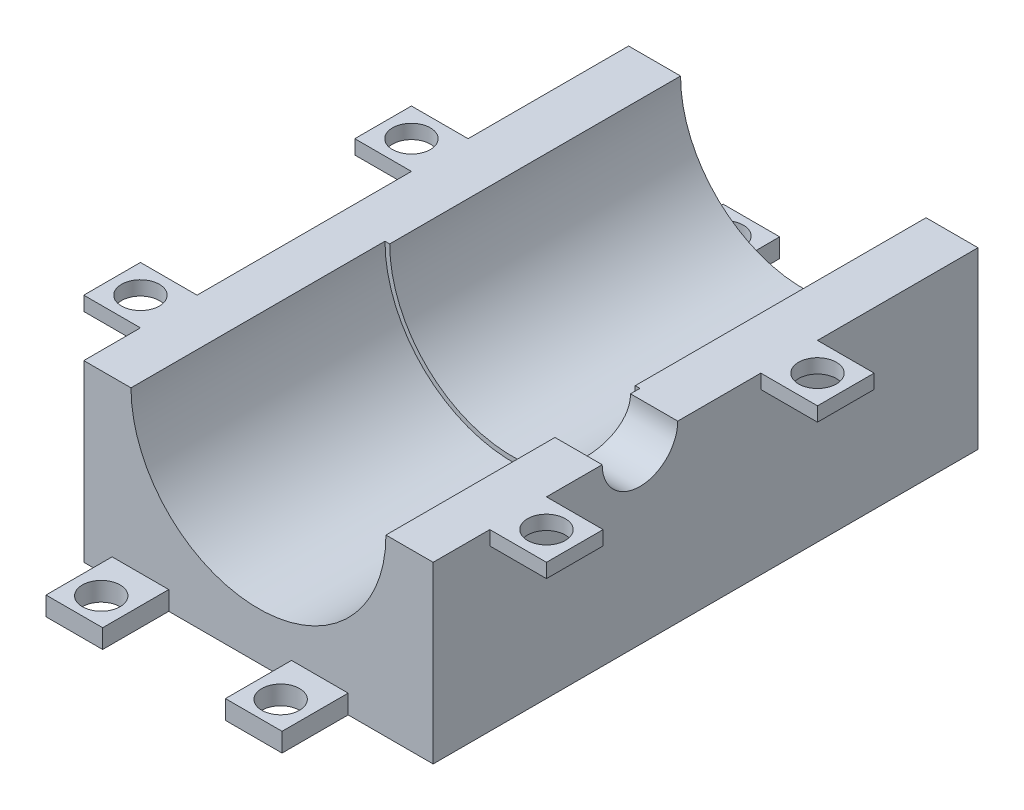
from build123d import *

# Parameters (mm, degrees)
EXTRUDE_1_DEPTH     = 57.7
EXTRUDE_2_DEPTH     = 30.8
SKETCH_5_R          = 4
CUT_EXTRUDE_1_DEPTH = 15
SKETCH_7_W          = 6
SKETCH_7_H          = 7
SKETCH_7_R          = 2
EXTRUDE_3_DEPTH     = 2
SKETCH_8_W          = 6
SKETCH_8_H          = 1.5
EXTRUDE_4_DEPTH     = 6
EXTRUDE_START       = -37
SKETCH_8_3_W        = 6
SKETCH_8_3_H        = 1.5
EXTRUDE_5_DEPTH     = 6
SKETCH_9_R          = 2
CUT_EXTRUDE_2_DEPTH = 6
SKETCH_10_R         = 13
CUT_EXTRUDE_3_DEPTH = 49.696406438


with BuildPart() as part:
    # 스케치1 → 보스-돌출1 (new body)
    with BuildSketch(Plane.XY):
        with BuildLine():
            Line((-13.5, 0), (-18.5, 0))
            Line((-18.5, 0), (-18.5, -18.5))
            Line((-18.5, -18.5), (18.5, -18.5))
            Line((18.5, -18.5), (18.5, 0))
            Line((18.5, 0), (13.5, 0))
            ThreePointArc((13.5, 0), (0, -13.5), (-13.5, 0))
        make_face()
    extrude(amount=-EXTRUDE_1_DEPTH)

    # 스케치3 → 보스-돌출2 (add)
    with BuildSketch(Plane.XY.offset(-26.9)):
        with BuildLine():
            Line((-13.5, 0), (-11.5, 0))
            ThreePointArc((-11.5, 0), (0, -11.5), (11.5, 0))
            Line((11.5, 0), (13.5, 0))
            ThreePointArc((13.5, 0), (0, -13.5), (-13.5, 0))
        make_face()
    extrude(amount=-EXTRUDE_2_DEPTH)

    # 스케치5 → 컷-돌출1 (cut)
    with BuildSketch(Plane.ZY.offset(-18.5)):
        with Locations((-21.9, 0)):
            Circle(SKETCH_5_R)
    extrude(amount=CUT_EXTRUDE_1_DEPTH, mode=Mode.SUBTRACT)

    # 스케치7 → 보스-돌출3 (add)
    # profile 1 of 2: a face of its own
    with BuildSketch(Plane.XZ.offset(18.5)):
        with Locations((6.5, 3.5)):
            Rectangle(SKETCH_7_W, SKETCH_7_H)
        with Locations(Location((6.5, 4.15, 0), (0, 0, 270))):
            Circle(SKETCH_7_R, mode=Mode.SUBTRACT)
    # profile 2 of 2: a face of its own
    with BuildSketch(Plane.XZ.offset(18.5)):
        with Locations((-12.5, 3.5)):
            Rectangle(SKETCH_7_W, SKETCH_7_H)
        with Locations(Location((-12.5, 4.15, 0), (0, 0, 270))):
            Circle(SKETCH_7_R, mode=Mode.SUBTRACT)
    extrude_3 = extrude(amount=-EXTRUDE_3_DEPTH)

    # 대칭 복사1: 보스-돌출3 across plane
    add(extrude_3.mirror(Plane.XY.offset(-28.85)))

    # 스케치8 → 보스-돌출4 (add)
    with BuildSketch(Plane.ZY.offset(18.5)):
        with Locations((-9, -0.75)):
            Rectangle(SKETCH_8_W, SKETCH_8_H)
        with Locations((-37.7, -0.75)):
            Rectangle(SKETCH_8_W, SKETCH_8_H)
    extrude(amount=EXTRUDE_4_DEPTH)

    # 스케치8<3> → 보스-돌출5 (add)
    with BuildSketch(Plane.ZY.offset(18.5).offset(EXTRUDE_START)):
        with Locations((-9, -0.75)):
            Rectangle(SKETCH_8_3_W, SKETCH_8_3_H)
        with Locations((-37.7, -0.75)):
            Rectangle(SKETCH_8_3_W, SKETCH_8_3_H)
    extrude(amount=-EXTRUDE_5_DEPTH)

    # 스케치9 → 컷-돌출2 (cut)
    with BuildSketch(Plane(origin=(0, 0, 0), x_dir=(1, 0, 0), z_dir=(0, 1, 0))):
        with Locations(Location((-21.5, 37.7, 0), (0, 0, 180))):
            Circle(SKETCH_9_R)
        with Locations(Location((-21.5, 9, 0), (0, 0, 180))):
            Circle(SKETCH_9_R)
        with Locations(Location((21.5, 9, 0), (0, 0, 180))):
            Circle(SKETCH_9_R)
        with Locations(Location((21.5, 37.7, 0), (0, 0, 90))):
            Circle(SKETCH_9_R)
    extrude(amount=-CUT_EXTRUDE_2_DEPTH, mode=Mode.SUBTRACT)

    # 스케치10 → 컷-돌출3 (cut, through all)
    with BuildSketch(Plane.XY.offset(-26.9)):
        Circle(SKETCH_10_R)
    extrude(amount=-CUT_EXTRUDE_3_DEPTH, mode=Mode.SUBTRACT)


solid = part.part
